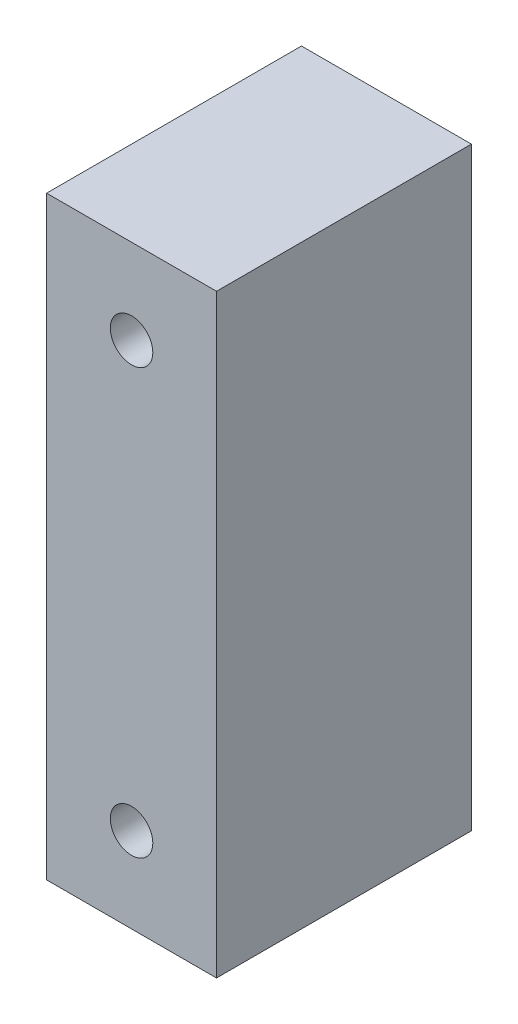
from build123d import *

# Parameters (mm, degrees)
SKETCH1_W           = 60
SKETCH1_H           = 210
BOSS_EXTRUDE1_DEPTH = 90
CUT_EXTRUDE1_REACH  = 143.51
SKETCH2_R           = 7.5


with BuildPart() as part:
    # Sketch1 → Boss-Extrude1 (new body)
    with BuildSketch(Plane.XY):
        Rectangle(SKETCH1_W, SKETCH1_H)
    extrude(amount=BOSS_EXTRUDE1_DEPTH)

    # Sketch2 → Cut-Extrude1 (cut, up to next)
    with BuildSketch(Plane.XY.offset(90), mode=Mode.PRIVATE) as cut_extrude1_sk1:
        with Locations((0, 75)):
            Circle(SKETCH2_R)
    cut_extrude1_tool1 = extrude(cut_extrude1_sk1.sketch, amount=-CUT_EXTRUDE1_REACH, mode=Mode.PRIVATE) & part.part
    # Sketch2 → Cut-Extrude1 (cut, up to next)
    with BuildSketch(Plane.XY.offset(90), mode=Mode.PRIVATE) as cut_extrude1_sk2:
        with Locations((0, -75)):
            Circle(SKETCH2_R)
    cut_extrude1_tool2 = extrude(cut_extrude1_sk2.sketch, amount=-CUT_EXTRUDE1_REACH, mode=Mode.PRIVATE) & part.part
    add(cut_extrude1_tool1.solids().sort_by_distance((0, 75, 90))[0], mode=Mode.SUBTRACT)
    add(cut_extrude1_tool2.solids().sort_by_distance((0, -75, 90))[0], mode=Mode.SUBTRACT)


solid = part.part
